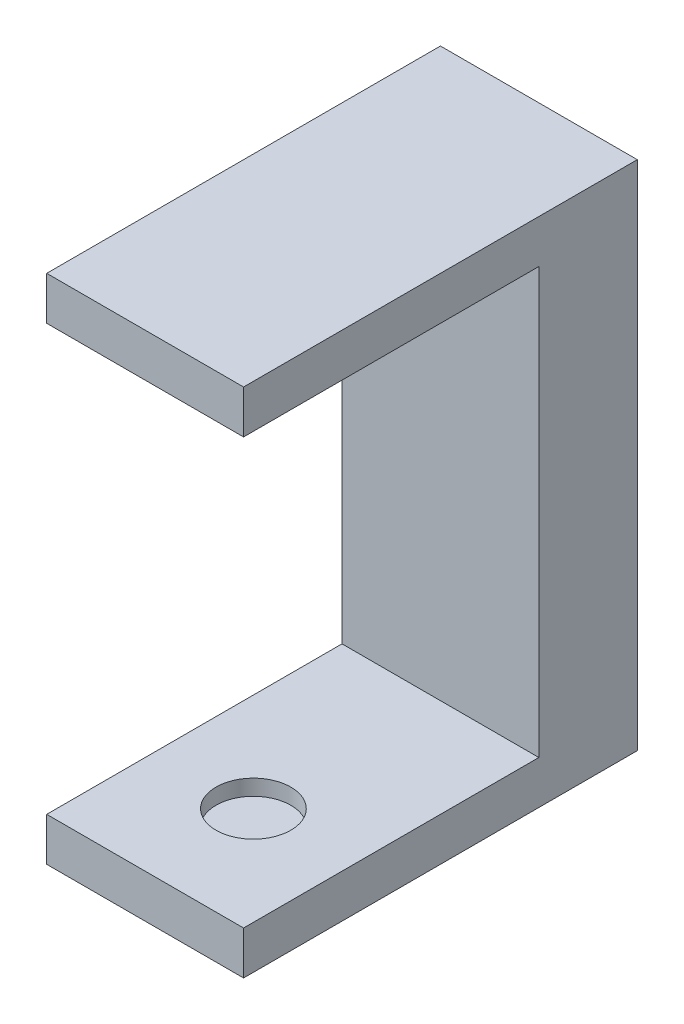
from build123d import *

# Parameters (mm, degrees)
SKETCH1_W           = 26
SKETCH1_H           = 10
BOSS_EXTRUDE1_DEPTH = 20
SKETCH2_W           = 10
SKETCH2_H           = 21.6
CUT_EXTRUDE1_DEPTH  = 15
SKETCH3_R           = 1.9
CUT_EXTRUDE2_DEPTH  = 0.8


with BuildPart() as part:
    # Sketch1 → Boss-Extrude1 (new body)
    with BuildSketch(Plane(origin=(0, 0, 0), x_dir=(0, 1, 0), z_dir=(0, 0, 1))):
        Rectangle(SKETCH1_W, SKETCH1_H)
    extrude(amount=BOSS_EXTRUDE1_DEPTH)

    # Sketch2 → Cut-Extrude1 (cut)
    with BuildSketch(Plane.XY.offset(20)):
        Rectangle(SKETCH2_W, SKETCH2_H)
    extrude(amount=-CUT_EXTRUDE1_DEPTH, mode=Mode.SUBTRACT)

    # Sketch3 → Cut-Extrude2 (cut)
    with BuildSketch(Plane(origin=(0, -10.8, 0), x_dir=(-1, 0, 0), z_dir=(0, 1, 0))):
        with Locations(Location((0, 14.5, 0), (0, 0, 90))):
            Circle(SKETCH3_R)
    cut_extrude2 = extrude(amount=-CUT_EXTRUDE2_DEPTH, mode=Mode.SUBTRACT)

    # Mirror1: Cut-Extrude2 across plane
    add(cut_extrude2.mirror(Plane.ZX), mode=Mode.SUBTRACT)


solid = part.part
